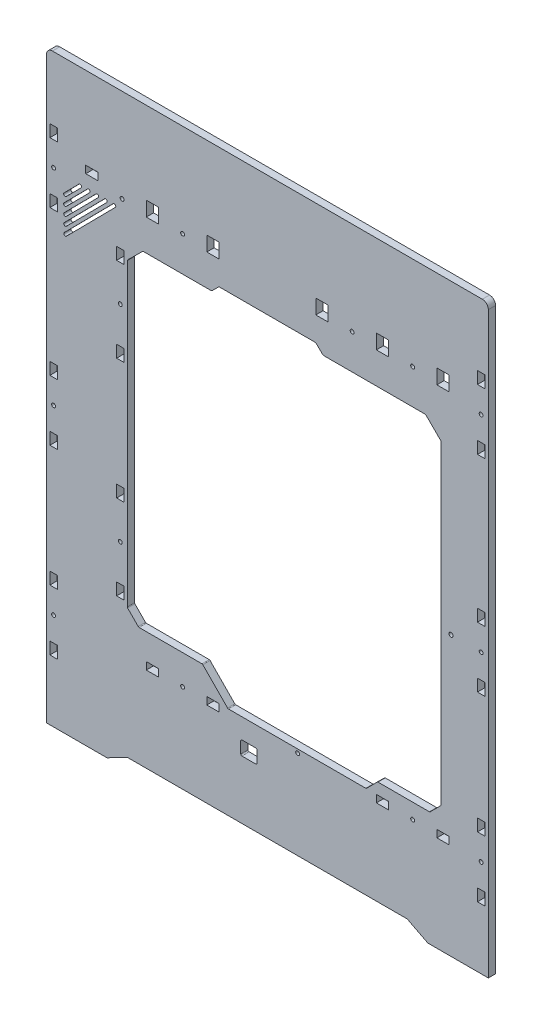
from build123d import *

# Parameters (mm, degrees)
SKETCH_1_R      = 1.6
SKETCH_1_R_2    = 1.7
SKETCH_1_W      = 6.1
SKETCH_1_H      = 10
SKETCH_1_W_2    = 10
SKETCH_1_H_2    = 6.1
SKETCH_1_H_3    = 12.1
EXTRUDE_1_DEPTH = 6


with BuildPart() as part:
    # Эскиз1 → Бобышка-Вытянуть1 (new body)
    with BuildSketch(Plane.XY):
        with BuildLine():
            Line((1133.366546195, 477.00723929), (1133.366546195, 520.00723929))
            ThreePointArc((1133.366546195, 520.00723929), (1131.902080101, 523.542773196), (1128.366546195, 525.00723929))
            Line((1128.366546195, 525.00723929), (773.366546195, 525.00723929))
            ThreePointArc((773.366546195, 525.00723929), (769.831012289, 523.542773196), (768.366546195, 520.00723929))
            Line((768.366546195, 520.00723929), (768.366546195, 477.00723929))
            Line((768.366546195, 477.00723929), (768.366546195, 42.00723929))
            Line((768.366546195, 42.00723929), (818.366546195, 42.00723929))
            Line((818.366546195, 42.00723929), (835.366546195, 50.73749629))
            Line((835.366546195, 50.73749629), (1066.366546195, 50.73749629))
            Line((1066.366546195, 50.73749629), (1083.366546195, 42.00723929))
            Line((1083.366546195, 42.00723929), (1133.366546195, 42.00723929))
            Line((1133.366546195, 42.00723929), (1133.366546195, 477.00723929))
        make_face()
        with Locations((1127.416546195, 272.00723929)):
            Circle(SKETCH_1_R, mode=Mode.SUBTRACT)
        with Locations((1102.521049053, 272.00723929)):
            Circle(SKETCH_1_R_2, mode=Mode.SUBTRACT)
        with Locations((1127.416546195, 122.00723929)):
            Circle(SKETCH_1_R, mode=Mode.SUBTRACT)
        with Locations((1070.866546195, 124.05491429)):
            Circle(SKETCH_1_R, mode=Mode.SUBTRACT)
        with Locations((975.866546195, 124.05491402)):
            Circle(SKETCH_1_R, mode=Mode.SUBTRACT)
        with Locations((880.866546195, 124.05491429)):
            Circle(SKETCH_1_R, mode=Mode.SUBTRACT)
        with Locations((774.316546195, 122.00723929)):
            Circle(SKETCH_1_R, mode=Mode.SUBTRACT)
        with Locations((829.416546195, 202.00723929)):
            Circle(SKETCH_1_R, mode=Mode.SUBTRACT)
        with Locations((774.316546195, 272.00723929)):
            Circle(SKETCH_1_R, mode=Mode.SUBTRACT)
        with Locations((1127.416546195, 442.00723929)):
            Circle(SKETCH_1_R, mode=Mode.SUBTRACT)
        with Locations((1070.866546195, 448.05723929)):
            Circle(SKETCH_1_R, mode=Mode.SUBTRACT)
        with Locations((1020.866546195, 448.05723929)):
            Circle(SKETCH_1_R, mode=Mode.SUBTRACT)
        with Locations((880.866546195, 448.05723929)):
            Circle(SKETCH_1_R, mode=Mode.SUBTRACT)
        with Locations((830.866546195, 448.05723929)):
            Circle(SKETCH_1_R, mode=Mode.SUBTRACT)
        with Locations((774.316546195, 442.00723929)):
            Circle(SKETCH_1_R, mode=Mode.SUBTRACT)
        with Locations((829.416546195, 372.00723929)):
            Circle(SKETCH_1_R, mode=Mode.SUBTRACT)
        with Locations((1127.416546195, 297.00723929)):
            Rectangle(SKETCH_1_W, SKETCH_1_H, mode=Mode.SUBTRACT)
        with Locations((1127.416546195, 247.00723929)):
            Rectangle(SKETCH_1_W, SKETCH_1_H, mode=Mode.SUBTRACT)
        with Locations((1127.416546195, 147.00723929)):
            Rectangle(SKETCH_1_W, SKETCH_1_H, mode=Mode.SUBTRACT)
        with Locations((1127.416546195, 97.00723929)):
            Rectangle(SKETCH_1_W, SKETCH_1_H, mode=Mode.SUBTRACT)
        with Locations((1095.866546195, 124.05491429)):
            Rectangle(SKETCH_1_W_2, SKETCH_1_H_2, mode=Mode.SUBTRACT)
        with Locations((1045.866546195, 124.05491429)):
            Rectangle(SKETCH_1_W_2, SKETCH_1_H_2, mode=Mode.SUBTRACT)
        with BuildLine():
            Line((941.366546195, 110.50491429), (929.866546195, 110.50491429))
            ThreePointArc((929.866546195, 110.50491429), (929.159439413, 110.212021071), (928.866546195, 109.50491429))
            Line((928.866546195, 109.50491429), (928.866546195, 100.00491429))
            ThreePointArc((928.866546195, 100.00491429), (929.159439413, 99.297807509), (929.866546195, 99.00491429))
            Line((929.866546195, 99.00491429), (941.366546195, 99.00491429))
            ThreePointArc((941.366546195, 99.00491429), (942.073652976, 99.297807509), (942.366546195, 100.00491429))
            Line((942.366546195, 100.00491429), (942.366546195, 109.50491429))
            ThreePointArc((942.366546195, 109.50491429), (942.073652976, 110.212021071), (941.366546195, 110.50491429))
        make_face(mode=Mode.SUBTRACT)
        with Locations((905.866546195, 124.05491429)):
            Rectangle(SKETCH_1_W_2, SKETCH_1_H_2, mode=Mode.SUBTRACT)
        with Locations((855.866546195, 124.05491429)):
            Rectangle(SKETCH_1_W_2, SKETCH_1_H_2, mode=Mode.SUBTRACT)
        with Locations((774.316546195, 97.00723929)):
            Rectangle(SKETCH_1_W, SKETCH_1_H, mode=Mode.SUBTRACT)
        with Locations((774.316546195, 147.00723929)):
            Rectangle(SKETCH_1_W, SKETCH_1_H, mode=Mode.SUBTRACT)
        with Locations((829.416546195, 166.80723929)):
            Rectangle(SKETCH_1_W, SKETCH_1_H, mode=Mode.SUBTRACT)
        with Locations((829.416546195, 236.80723929)):
            Rectangle(SKETCH_1_W, SKETCH_1_H, mode=Mode.SUBTRACT)
        with Locations((774.316546195, 247.00723929)):
            Rectangle(SKETCH_1_W, SKETCH_1_H, mode=Mode.SUBTRACT)
        with Locations((1127.416546195, 417.00723929)):
            Rectangle(SKETCH_1_W, SKETCH_1_H, mode=Mode.SUBTRACT)
        with Locations((1127.416546195, 467.00723929)):
            Rectangle(SKETCH_1_W, SKETCH_1_H, mode=Mode.SUBTRACT)
        with Locations((1095.866546195, 451.05723929)):
            Rectangle(SKETCH_1_W_2, SKETCH_1_H_3, mode=Mode.SUBTRACT)
        with Locations((1045.866546195, 451.05723929)):
            Rectangle(SKETCH_1_W_2, SKETCH_1_H_3, mode=Mode.SUBTRACT)
        with Locations((995.866546195, 451.05723929)):
            Rectangle(SKETCH_1_W_2, SKETCH_1_H_3, mode=Mode.SUBTRACT)
        with Locations((905.866546195, 451.05723929)):
            Rectangle(SKETCH_1_W_2, SKETCH_1_H_3, mode=Mode.SUBTRACT)
        with Locations((829.416546195, 406.80723929)):
            Rectangle(SKETCH_1_W, SKETCH_1_H, mode=Mode.SUBTRACT)
        with BuildLine():
            Line((996.280759757, 419.755099318), (991.452332632, 424.583526443))
            ThreePointArc((991.452332632, 424.583526443), (990.803485935, 425.017071946), (990.03811907, 425.169312881))
            Line((990.03811907, 425.169312881), (911.694973319, 425.169312881))
            ThreePointArc((911.694973319, 425.169312881), (910.929606455, 425.017071946), (910.280759757, 424.583526443))
            Line((910.280759757, 424.583526443), (905.452332632, 419.755099318))
            ThreePointArc((905.452332632, 419.755099318), (904.803485935, 419.321553816), (904.03811907, 419.169312881))
            Line((904.03811907, 419.169312881), (848.462490515, 419.169312881))
            ThreePointArc((848.462490515, 419.169312881), (848.08143985, 419.093867148), (847.757886515, 418.878913881))
            Line((847.757886515, 418.878913881), (835.464673515, 406.672272881))
            ThreePointArc((835.464673515, 406.672272881), (835.246075427, 406.346986998), (835.169277515, 405.962671881))
            Line((835.169277515, 405.962671881), (835.169277515, 158.363740881))
            ThreePointArc((835.169277515, 158.363740881), (835.244381748, 157.983519619), (835.458413515, 157.660410881))
            Line((835.458413515, 157.660410881), (844.227597515, 148.797302881))
            ThreePointArc((844.227597515, 148.797302881), (844.553318068, 148.577776538), (844.938460515, 148.500633881))
            Line((844.938460515, 148.500633881), (896.861307515, 148.500633881))
            ThreePointArc((896.861307515, 148.500633881), (897.24797934, 148.422851364), (897.574498515, 148.201603881))
            Line((897.574498515, 148.201603881), (918.015788515, 127.403942881))
            ThreePointArc((918.015788515, 127.403942881), (918.34230769, 127.182695398), (918.728979515, 127.104912881))
            Line((918.728979515, 127.104912881), (1032.102487515, 127.104912881))
            ThreePointArc((1032.102487515, 127.104912881), (1032.487630078, 127.182055999), (1032.813350515, 127.401582881))
            Line((1032.813350515, 127.401582881), (1041.578144515, 136.260254881))
            ThreePointArc((1041.578144515, 136.260254881), (1041.903865529, 136.479781416), (1042.289008515, 136.556923881))
            Line((1042.289008515, 136.556923881), (1084.646289515, 136.556923881))
            ThreePointArc((1084.646289515, 136.556923881), (1085.031432616, 136.634066807), (1085.357153515, 136.853593881))
            Line((1085.357153515, 136.853593881), (1094.126336515, 145.716701881))
            ThreePointArc((1094.126336515, 145.716701881), (1094.340368819, 146.039810505), (1094.415473515, 146.420031881))
            Line((1094.415473515, 146.420031881), (1094.415473515, 405.962671881))
            ThreePointArc((1094.415473515, 405.962671881), (1094.338675602, 406.346986998), (1094.120077515, 406.672272881))
            Line((1094.120077515, 406.672272881), (1081.826864515, 418.878913881))
            ThreePointArc((1081.826864515, 418.878913881), (1081.50331118, 419.093867148), (1081.122260515, 419.169312881))
            Line((1081.122260515, 419.169312881), (997.694973319, 419.169312881))
            ThreePointArc((997.694973319, 419.169312881), (996.929606455, 419.321553816), (996.280759757, 419.755099318))
        make_face(mode=Mode.SUBTRACT)
        with Locations((855.866546195, 451.05723929)):
            Rectangle(SKETCH_1_W_2, SKETCH_1_H_3, mode=Mode.SUBTRACT)
        with BuildLine():
            Line((784.872143195, 398.27114029), (825.305532195, 439.15378929))
            ThreePointArc((825.305532195, 439.15378929), (825.295766195, 440.92152929), (823.528026195, 440.91176329))
            Line((823.528026195, 440.91176329), (783.094636195, 400.02911329))
            ThreePointArc((783.094636195, 400.02911329), (783.104403195, 398.26137329), (784.872143195, 398.27114029))
        make_face(mode=Mode.SUBTRACT)
        with BuildLine():
            Line((784.833077195, 405.34210029), (818.234572195, 439.11472329))
            ThreePointArc((818.234572195, 439.11472329), (818.224806195, 440.88246329), (816.457066195, 440.87269729))
            Line((816.457066195, 440.87269729), (783.055570195, 407.10007329))
            ThreePointArc((783.055570195, 407.10007329), (783.065337195, 405.33233329), (784.833077195, 405.34210029))
        make_face(mode=Mode.SUBTRACT)
        with BuildLine():
            Line((784.794011195, 412.41306029), (811.163612195, 439.07565729))
            ThreePointArc((811.163612195, 439.07565729), (811.153846195, 440.84339729), (809.386106195, 440.83363129))
            Line((809.386106195, 440.83363129), (783.016504195, 414.17103329))
            ThreePointArc((783.016504195, 414.17103329), (783.026271195, 412.40329329), (784.794011195, 412.41306029))
        make_face(mode=Mode.SUBTRACT)
        with BuildLine():
            Line((784.754944195, 419.48402029), (804.092652195, 439.03659129))
            ThreePointArc((804.092652195, 439.03659129), (804.082886195, 440.80433129), (802.315146195, 440.79456529))
            Line((802.315146195, 440.79456529), (782.977438195, 421.24199329))
            ThreePointArc((782.977438195, 421.24199329), (782.987204695, 419.47425379), (784.754944195, 419.48402029))
        make_face(mode=Mode.SUBTRACT)
        with BuildLine():
            Line((784.715878195, 426.55498029), (797.021693195, 438.99752529))
            ThreePointArc((797.021693195, 438.99752529), (797.011926195, 440.76526529), (795.244186195, 440.75549829))
            Line((795.244186195, 440.75549829), (782.938372195, 428.31295329))
            ThreePointArc((782.938372195, 428.31295329), (782.948138695, 426.54521379), (784.715878195, 426.55498029))
        make_face(mode=Mode.SUBTRACT)
        with Locations((774.316546195, 417.00723929)):
            Rectangle(SKETCH_1_W, SKETCH_1_H, mode=Mode.SUBTRACT)
        with Locations((805.866546195, 454.05723929)):
            Rectangle(SKETCH_1_W_2, SKETCH_1_H_2, mode=Mode.SUBTRACT)
        with Locations((774.316546195, 467.00723929)):
            Rectangle(SKETCH_1_W, SKETCH_1_H, mode=Mode.SUBTRACT)
        with Locations((829.416546195, 336.80723929)):
            Rectangle(SKETCH_1_W, SKETCH_1_H, mode=Mode.SUBTRACT)
        with Locations((774.316546195, 297.00723929)):
            Rectangle(SKETCH_1_W, SKETCH_1_H, mode=Mode.SUBTRACT)
    extrude(amount=EXTRUDE_1_DEPTH)


solid = part.part
